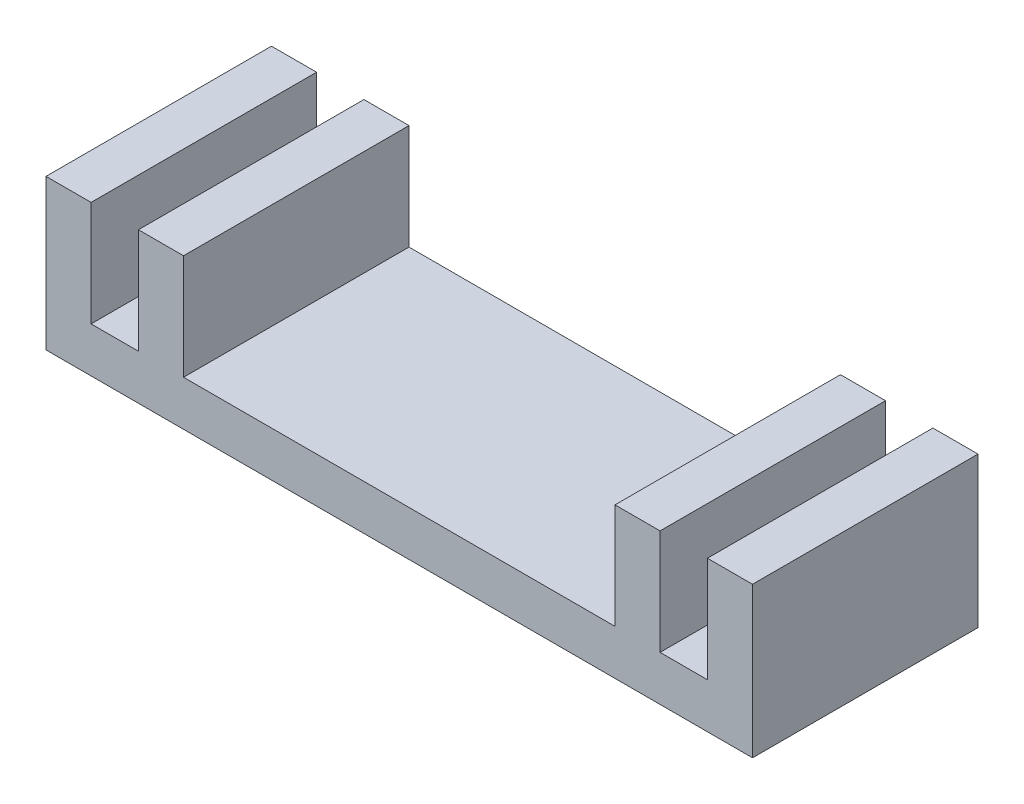
from build123d import *

# Parameters (mm, degrees)
DODANIE_WYCI_GNI_CIE1_DEPTH = 15


with BuildPart() as part:
    # Szkic1 → Dodanie-wyciągnięcie1 (new body)
    with BuildSketch(Plane.XY):
        Polygon((20.5, 0), (-20.5, 0), (-23.5, 0), (-23.5, 10), (-20.5, 10), (-20.5, 3), (-17.35, 3), (-17.35, 10), (-14.351157044, 10), (-14.351157044, 3), (14.351157044, 3), (14.351157044, 10), (17.35, 10), (17.35, 3), (20.5, 3), (20.5, 10), (23.5, 10), (23.5, 0), align=None)
    extrude(amount=DODANIE_WYCI_GNI_CIE1_DEPTH)


solid = part.part
